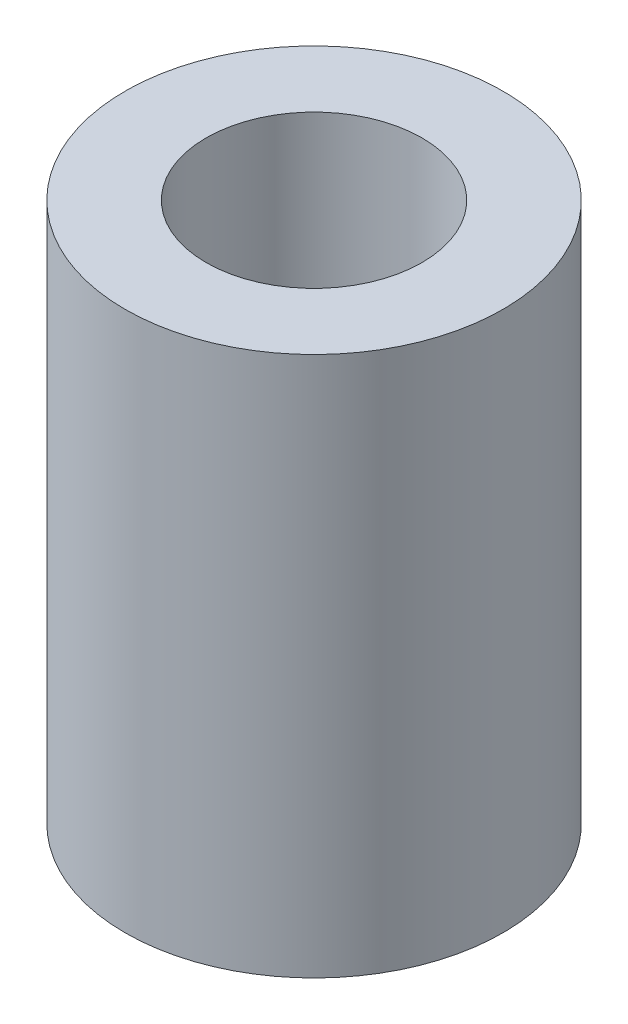
from build123d import *

# Parameters (mm, degrees)
SKETCH_1_R      = 10.5
SKETCH_1_R_2    = 6
EXTRUDE_1_DEPTH = 30


with BuildPart() as part:
    # 草图1 → 凸台-拉伸1 (new body)
    with BuildSketch(Plane(origin=(0, 0, 0), x_dir=(1, 0, 0), z_dir=(0, 1, 0))):
        with Locations(Location((0, 0, 0), (0, 0, 270))):
            Circle(SKETCH_1_R)
        with Locations(Location((0, 0, 0), (0, 0, 270))):
            Circle(SKETCH_1_R_2, mode=Mode.SUBTRACT)
    extrude(amount=EXTRUDE_1_DEPTH)


solid = part.part
